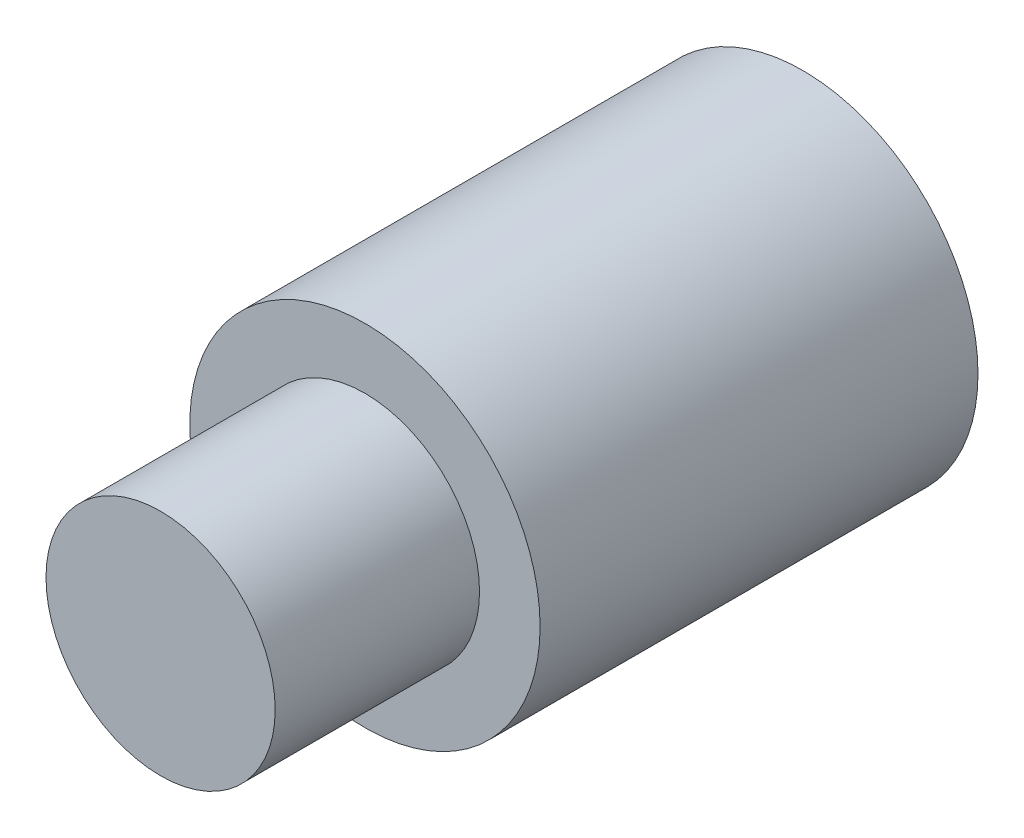
from build123d import *

# Parameters (mm, degrees)
SKIZZE1_R                       = 6
AUFSATZ_LINEAR_AUSTRAGEN1_DEPTH = 15
SKIZZE2_R                       = 3.925
AUFSATZ_LINEAR_AUSTRAGEN2_DEPTH = 7


with BuildPart() as part:
    # Skizze1 → Aufsatz-Linear austragen1 (new body)
    with BuildSketch(Plane.XY):
        Circle(SKIZZE1_R)
    extrude(amount=AUFSATZ_LINEAR_AUSTRAGEN1_DEPTH)

    # Skizze2 → Aufsatz-Linear austragen2 (add)
    with BuildSketch(Plane.XY.offset(15)):
        Circle(SKIZZE2_R)
    extrude(amount=AUFSATZ_LINEAR_AUSTRAGEN2_DEPTH)


solid = part.part
